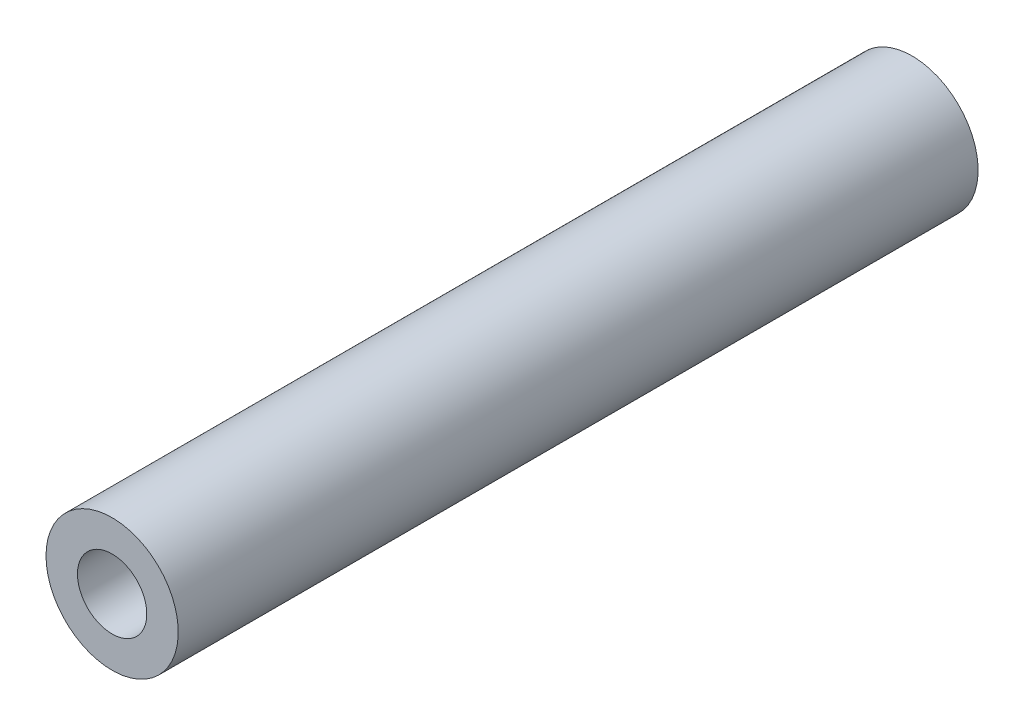
from build123d import *

# Parameters (mm, degrees)
SKETCH1_R      = 1.5748
SKETCH1_R_2    = 0.8255
EXTRUDE1_DEPTH = 19.05


with BuildPart() as part:
    # Sketch1 → Extrude1 (new body)
    with BuildSketch(Plane.XY):
        with Locations(Location((0, 0, 0), (0, 0, 180))):
            Circle(SKETCH1_R)
        with Locations(Location((0, 0, 0), (0, 0, 180))):
            Circle(SKETCH1_R_2, mode=Mode.SUBTRACT)
    extrude(amount=EXTRUDE1_DEPTH)


solid = part.part
